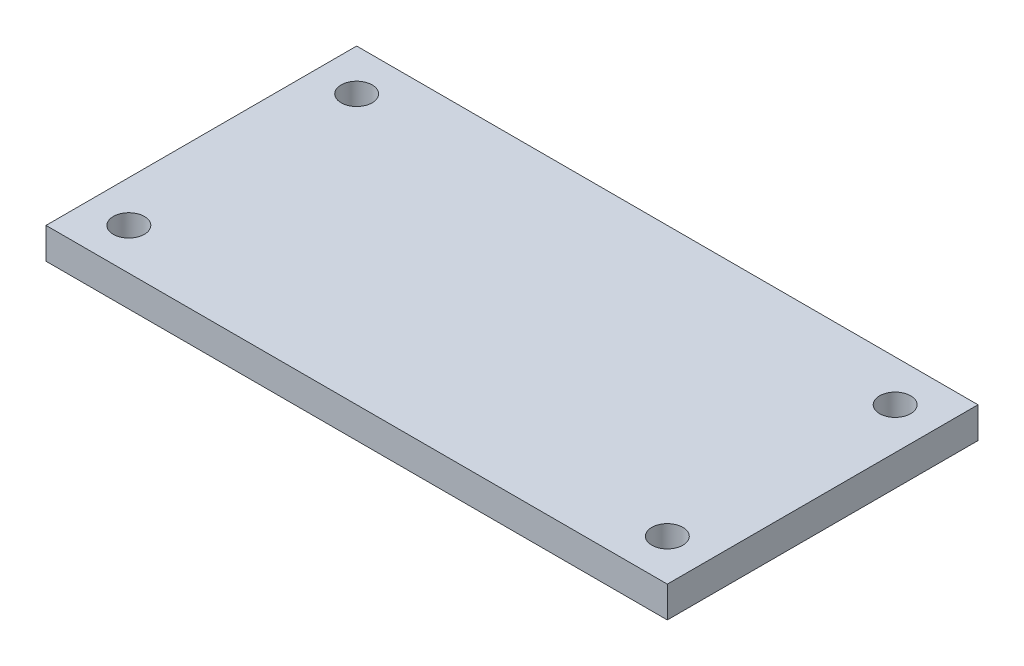
from build123d import *

# Parameters (mm, degrees)
CROQUIS1_R              = 1.5
SALIENTE_EXTRUIR1_DEPTH = 3


with BuildPart() as part:
    # Croquis1 → Saliente-Extruir1 (new body)
    with BuildSketch(Plane(origin=(0, 0, 0), x_dir=(1, 0, 0), z_dir=(0, 1, 0))):
        Polygon((-30, 0), (-30, 15), (0, 15), (30, 15), (30, 0), (30, -15), (-14.262295082, -15), (-30, -15), align=None)
        with Locations(Location((-26, 11, 0), (0, 0, 270))):
            Circle(CROQUIS1_R, mode=Mode.SUBTRACT)
        with Locations(Location((26, 11, 0), (0, 0, 90))):
            Circle(CROQUIS1_R, mode=Mode.SUBTRACT)
        with Locations(Location((26, -11, 0), (0, 0, 270))):
            Circle(CROQUIS1_R, mode=Mode.SUBTRACT)
        with Locations(Location((-26, -11, 0), (0, 0, 90))):
            Circle(CROQUIS1_R, mode=Mode.SUBTRACT)
    extrude(amount=SALIENTE_EXTRUIR1_DEPTH)


solid = part.part
